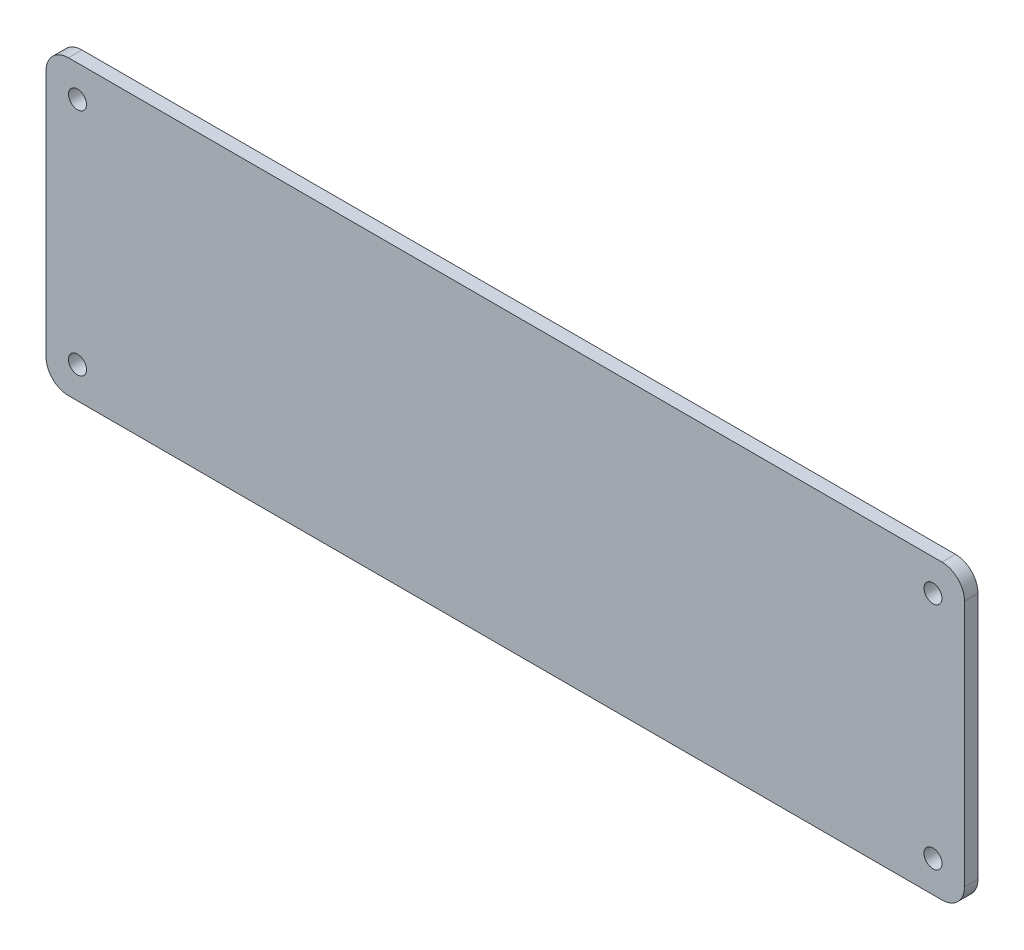
from build123d import *

# Parameters (mm, degrees)
SKETCH1_W           = 204
SKETCH1_H           = 65
SKETCH1_R           = 2
BOSS_EXTRUDE1_DEPTH = 1.5
FILLET1_R           = 5


with BuildPart() as part:
    # Sketch1 → Boss-Extrude1 (new, symmetric)
    with BuildSketch(Plane.XY):
        Rectangle(SKETCH1_W, SKETCH1_H)
        with Locations((95, -25.5)):
            Circle(SKETCH1_R, mode=Mode.SUBTRACT)
        with Locations((95, 25.5)):
            Circle(SKETCH1_R, mode=Mode.SUBTRACT)
        with Locations((-95, 25.5)):
            Circle(SKETCH1_R, mode=Mode.SUBTRACT)
        with Locations((-95, -25.5)):
            Circle(SKETCH1_R, mode=Mode.SUBTRACT)
    extrude(amount=BOSS_EXTRUDE1_DEPTH, both=True)

    # Fillet1
    fillet1_edges = [part.edges().sort_by_distance(p)[0] for p in [
        (102, -32.5, 0),
        (-102, -32.5, 0),
        (-102, 32.5, 0),
        (102, 32.5, 0),
    ]]
    fillet(fillet1_edges, radius=FILLET1_R)


solid = part.part
